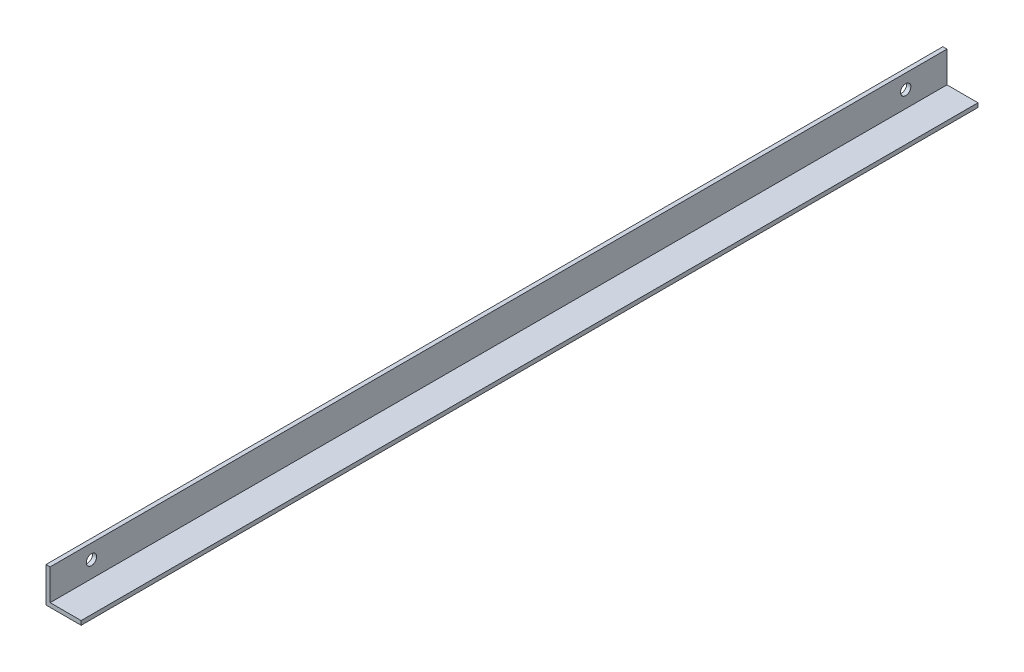
from build123d import *

# Parameters (mm, degrees)
EXTRUDE_1_DEPTH     = 434
SKETCH_2_R          = 2.5
CUT_EXTRUDE_1_DEPTH = 435.453679925
SKETCH_3_W          = 2
SKETCH_3_H          = 2
EXTRUDE_2_DEPTH     = 434


with BuildPart() as part:
    # Эскиз1 → Бобышка-Вытянуть1 (new body)
    with BuildSketch(Plane.XY):
        Polygon((0, 0), (0, 13), (-2, 13), (-2, -2), (13, -2), (13, 0), align=None)
    extrude(amount=-EXTRUDE_1_DEPTH)

    # Эскиз2 → Вырез-Вытянуть1 (cut, through all)
    with BuildSketch(Plane.ZY.offset(2)):
        with Locations(Location((-20, 8, 0), (0, 0, 270))):
            Circle(SKETCH_2_R)
        with Locations(Location((-414, 8, 0), (0, 0, 270))):
            Circle(SKETCH_2_R)
    extrude(amount=-CUT_EXTRUDE_1_DEPTH, mode=Mode.SUBTRACT)

    # Эскиз3 → Бобышка-Вытянуть2 (add)
    with BuildSketch(Plane(origin=(0, 0, -434), x_dir=(-1, 0, 0), z_dir=(0, 0, -1))):
        with Locations((1, 14)):
            Rectangle(SKETCH_3_W, SKETCH_3_H)
        with Locations((-14, -1)):
            Rectangle(SKETCH_3_W, SKETCH_3_H)
    extrude(amount=-EXTRUDE_2_DEPTH)


solid = part.part
